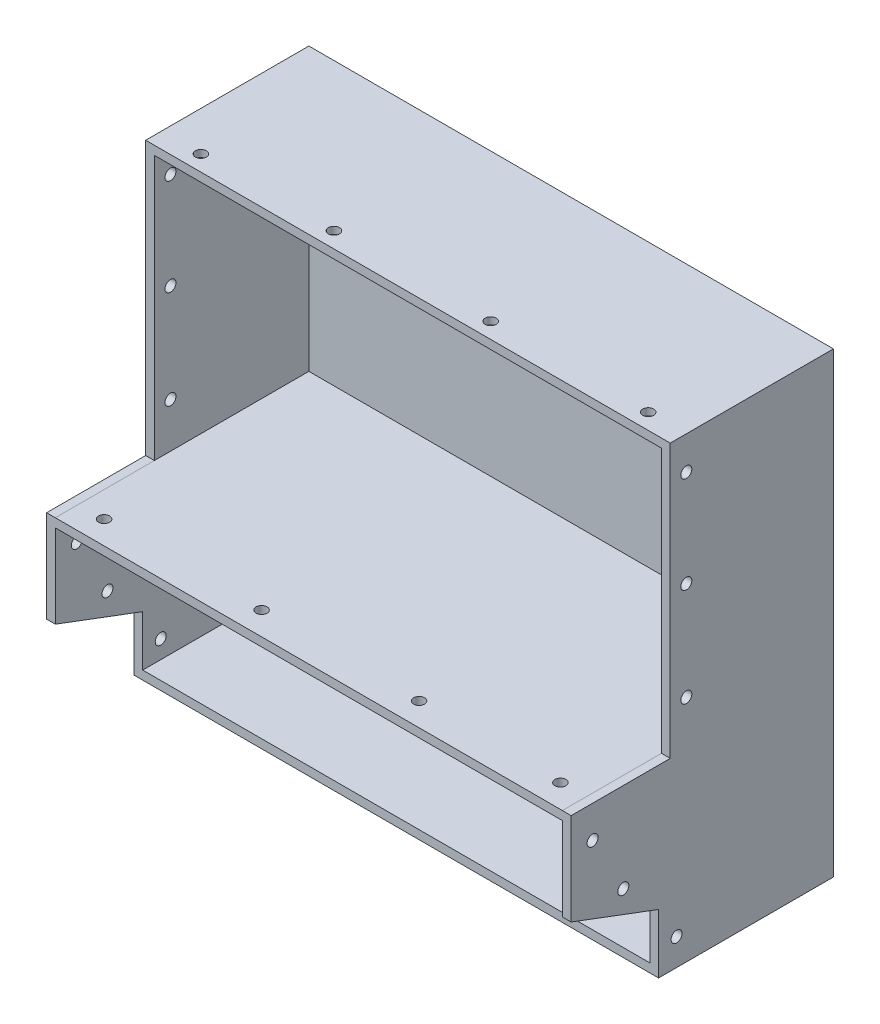
from build123d import *

# Parameters (mm, degrees)
SKETCH1_W           = 190.5
SKETCH1_H           = 166.116
BOSS_EXTRUDE1_DEPTH = 95.25
CUT_EXTRUDE1_DEPTH  = 92.075
CUT_EXTRUDE5_DEPTH  = 35.98418
SKETCH17_W          = 190.5
SKETCH17_H          = 33.474363619
CUT_EXTRUDE6_DEPTH  = 31.75
BOSS_EXTRUDE8_DEPTH = 190.5
SKETCH19_W          = 184.15
SKETCH19_H          = 30.313503047
CUT_EXTRUDE7_DEPTH  = 92.075
SKETCH20_W          = 184.15
SKETCH20_H          = 33.914711244
CUT_EXTRUDE8_DEPTH  = 13.175
CUT_EXTRUDE9_DEPTH  = 60.325
SKETCH23_R          = 2.00000108
CUT_EXTRUDE10_DEPTH = 2.54
SKETCH24_R          = 2
SKETCH24_R_2        = 2.00000108
CUT_EXTRUDE11_DEPTH = 2.54
SKETCH25_R          = 2.00000108
CUT_EXTRUDE12_DEPTH = 229.607619873
SKETCH27_R          = 2.00000108
CUT_EXTRUDE13_DEPTH = 3.175
SKETCH28_R          = 2.00000108
CUT_EXTRUDE15_DEPTH = 229.607619873


with BuildPart() as part:
    # Sketch1 → Boss-Extrude1 (new body)
    with BuildSketch(Plane.XY):
        Rectangle(SKETCH1_W, SKETCH1_H)
    extrude(amount=BOSS_EXTRUDE1_DEPTH)

    # Sketch3 → Cut-Extrude1 (cut)
    with BuildSketch(Plane.XY.offset(95.25)):
        Polygon((-92.075, 79.883), (-92.075, 32.891702926), (-92.075, -16.095133334), (92.075, -16.095133334), (92.075, 48.662739539), (92.075, 79.883), (83.88326961, 79.883), (-81.085829842, 79.883), align=None)
    extrude(amount=-CUT_EXTRUDE1_DEPTH, mode=Mode.SUBTRACT)

    # Sketch15 → Cut-Extrude5 (cut)
    with BuildSketch(Plane.XY.offset(95.25)):
        Polygon((95.25, -16.109272762), (95.25, 83.058), (-95.25, 83.058), (-95.25, -16.109272762), (-92.075, -16.095133334), (-92.075, 79.883), (92.075, 79.883), (92.075, -16.095133334), align=None)
    extrude(amount=-CUT_EXTRUDE5_DEPTH, mode=Mode.SUBTRACT)

    # Sketch17 → Cut-Extrude6 (cut)
    with BuildSketch(Plane.XY.offset(95.25)):
        with Locations((0, -66.320818191)):
            Rectangle(SKETCH17_W, SKETCH17_H)
    extrude(amount=-CUT_EXTRUDE6_DEPTH, mode=Mode.SUBTRACT)

    # Sketch18 → Boss-Extrude8 (add)
    with BuildSketch(Plane.ZY.offset(95.25)):
        Polygon((63.5, -49.583636381), (63.5, -61.506100001), (95.25, -49.583636381), align=None)
    extrude(amount=-BOSS_EXTRUDE8_DEPTH)

    # Sketch19 → Cut-Extrude7 (cut)
    with BuildSketch(Plane.XY.offset(95.25)):
        with Locations((0, -34.426884857)):
            Rectangle(SKETCH19_W, SKETCH19_H)
    extrude(amount=-CUT_EXTRUDE7_DEPTH, mode=Mode.SUBTRACT)

    # Sketch20 → Cut-Extrude8 (cut)
    with BuildSketch(Plane(origin=(0, -74.803163357, 28.08938563), x_dir=(1, 0, 0), z_dir=(0, -0.9361719099317519, 0.3515425366221503))):
        with Locations((0, 54.782261491)):
            Rectangle(SKETCH20_W, SKETCH20_H)
    extrude(amount=-CUT_EXTRUDE8_DEPTH, mode=Mode.SUBTRACT)

    # Sketch21 → Cut-Extrude9 (cut)
    with BuildSketch(Plane.XY.offset(63.5)):
        Polygon((-92.075, -61.506100001), (-92.075, -49.583636381), (92.075, -49.583636381), (92.075, -61.506100001), (92.075, -79.883), (-92.075, -79.883), align=None)
    extrude(amount=-CUT_EXTRUDE9_DEPTH, mode=Mode.SUBTRACT)

    # Sketch23 → Cut-Extrude10 (cut)
    with BuildSketch(Plane.XZ.offset(83.058)):
        with Locations(Location((-82.849188623, 55.000696991, 0), (0, 0, 270))):
            Circle(SKETCH23_R)
        with Locations(Location((-25.472016651, 55.000696991, 0), (0, 0, 270))):
            Circle(SKETCH23_R)
        with Locations(Location((31.523609513, 55.000696991, 0), (0, 0, 270))):
            Circle(SKETCH23_R)
        with Locations(Location((82.814656862, 55.000696991, 0), (0, 0, 270))):
            Circle(SKETCH23_R)
    extrude(amount=-CUT_EXTRUDE10_DEPTH, mode=Mode.SUBTRACT)

    # Sketch24 → Cut-Extrude11 (cut)
    with BuildSketch(Plane(origin=(0, 83.058, 0), x_dir=(1, 0, 0), z_dir=(0, 1, 0))):
        with Locations(Location((81.523328712, -53.55082, 0), (0, 0, 270))):
            Circle(SKETCH24_R)
        with Locations(Location((24.335748782, -53.55082, 0), (0, 0, 270))):
            Circle(SKETCH24_R_2)
        with Locations(Location((-32.590719569, -53.55082, 0), (0, 0, 270))):
            Circle(SKETCH24_R_2)
        with Locations(Location((-80.895203369, -53.55082, 0), (0, 0, 270))):
            Circle(SKETCH24_R_2)
    extrude(amount=-CUT_EXTRUDE11_DEPTH, mode=Mode.SUBTRACT)

    # Sketch25 → Cut-Extrude12 (cut, through all)
    with BuildSketch(Plane(origin=(95.25, 0, 0), x_dir=(0, 0, -1), z_dir=(1, 0, 0))):
        with Locations((-53.42382, 70.993)):
            Circle(SKETCH25_R)
        with Locations((-53.42382, 35.941)):
            Circle(SKETCH25_R)
        with Locations((-53.42382, 0.217760577)):
            Circle(SKETCH25_R)
    extrude(amount=-CUT_EXTRUDE12_DEPTH, mode=Mode.SUBTRACT)

    # Sketch27 → Cut-Extrude13 (cut)
    with BuildSketch(Plane(origin=(0, -16.095133334, 0), x_dir=(1, 0, 0), z_dir=(0, 1, 0))):
        with Locations(Location((82.927784397, -86.822835397, 0), (0, 0, 270))):
            Circle(SKETCH27_R)
        with Locations(Location((31.591922204, -86.822835397, 0), (0, 0, 270))):
            Circle(SKETCH27_R)
        with Locations(Location((-25.602288215, -86.822835397, 0), (0, 0, 270))):
            Circle(SKETCH27_R)
        with Locations(Location((-82.800527943, -86.822835397, 0), (0, 0, 270))):
            Circle(SKETCH27_R)
    extrude(amount=-CUT_EXTRUDE13_DEPTH, mode=Mode.SUBTRACT)

    # Sketch28 → Cut-Extrude15 (cut, through all)
    with BuildSketch(Plane(origin=(95.25, 0, 0), x_dir=(0, 0, -1), z_dir=(1, 0, 0))):
        with Locations((-56.96125, -73.285093297)):
            Circle(SKETCH28_R)
        with Locations((-76.306976382, -48.567809089)):
            Circle(SKETCH28_R)
        with Locations((-87.449753477, -27.794488932)):
            Circle(SKETCH28_R)
    extrude(amount=-CUT_EXTRUDE15_DEPTH, mode=Mode.SUBTRACT)


solid = part.part
